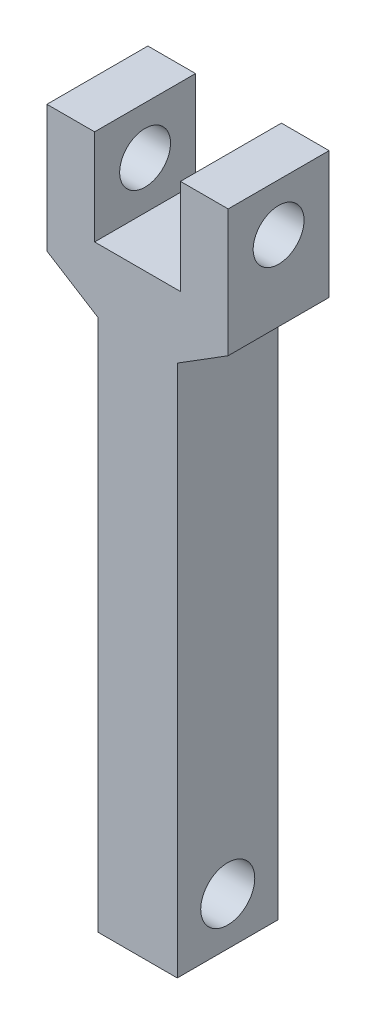
from build123d import *

# Parameters (mm, degrees)
BOSS_EXTRUDE1_DEPTH     = 3.175
CUT_EXTRUDE1_DEPTH      = 42.022196735
CUT_EXTRUDE1_DEPTH_BACK = 42.022196735
SKETCH2_R               = 1.7
SKETCH2_R_2             = 1.6


with BuildPart() as part:
    # Sketch1 → Boss-Extrude1 (new, symmetric)
    with BuildSketch(Plane.XY):
        Polygon((-2.5, -3), (2.5, -3), (2.5, 30.5), (5.7, 32.5), (5.7, 40.5), (2.7, 40.5), (2.7, 34.5), (-2.7, 34.5), (-2.7, 40.5), (-5.7, 40.5), (-5.7, 32.5), (-2.5, 30.5), align=None)
    extrude(amount=BOSS_EXTRUDE1_DEPTH, both=True)

    # Sketch2 → Cut-Extrude1 (cut, two sides: drawn at the far end of the back side and taken through both)
    with BuildSketch(Plane(origin=(0, 0, 0), x_dir=(0, 0, -1), z_dir=(1, 0, 0)).offset(-CUT_EXTRUDE1_DEPTH_BACK)):
        Circle(SKETCH2_R)
        with Locations((0, 37.5)):
            Circle(SKETCH2_R_2)
    extrude(amount=CUT_EXTRUDE1_DEPTH + CUT_EXTRUDE1_DEPTH_BACK, mode=Mode.SUBTRACT)


solid = part.part
